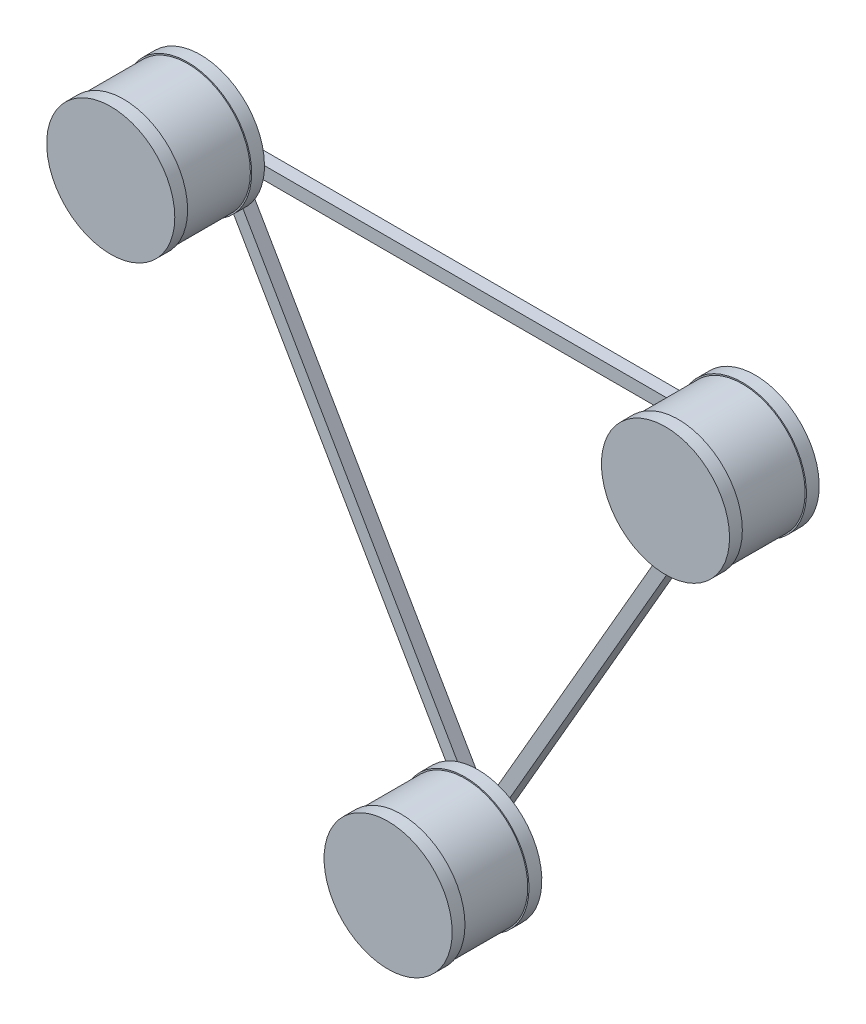
from build123d import *

# Parameters (mm, degrees)
BOSS_EXTRUDE1_DEPTH = 2.5
SKETCH2_R           = 25
BOSS_EXTRUDE2_DEPTH = 5
SKETCH3_R           = 5
BOSS_EXTRUDE3_DEPTH = 25
SKETCH4_R           = 25
BOSS_EXTRUDE4_DEPTH = 5
SKETCH5_R           = 24.5
SKETCH5_R_2         = 5.5
BOSS_EXTRUDE5_DEPTH = 25


with BuildPart() as part:
    # Sketch1 → Boss-Extrude1 (new, symmetric)
    with BuildSketch(Plane.XY):
        Polygon((0, -125), (-108.253175473, 62.5), (108.253175473, 62.5), align=None)
        Polygon((0, -115), (-99.592921435, 57.5), (99.592921435, 57.5), align=None, mode=Mode.SUBTRACT)
    extrude(amount=BOSS_EXTRUDE1_DEPTH, both=True)

    # Sketch2 → Boss-Extrude2 (add)
    with BuildSketch(Plane.XY.offset(2.5)):
        with Locations((-108.253175473, 62.5)):
            Circle(SKETCH2_R)
        with Locations(Location((108.253175473, 62.5, 0), (0, 0, 180))):
            Circle(SKETCH2_R)
        with Locations(Location((0, -125, 0), (0, 0, 120))):
            Circle(SKETCH2_R)
    extrude(amount=BOSS_EXTRUDE2_DEPTH)

    # Sketch3 → Boss-Extrude3 (add)
    with BuildSketch(Plane.XY.offset(7.5)):
        with Locations((-108.253175473, 62.5)):
            Circle(SKETCH3_R)
        with Locations(Location((108.253175473, 62.5, 0), (0, 0, 180))):
            Circle(SKETCH3_R)
        with Locations((0, -125)):
            Circle(SKETCH3_R)
    extrude(amount=BOSS_EXTRUDE3_DEPTH)

    # Sketch4 → Boss-Extrude4 (add)
    with BuildSketch(Plane.XY.offset(32.5)):
        with Locations(Location((0, -125, 0), (0, 0, 120))):
            Circle(SKETCH4_R)
        with Locations(Location((108.253175473, 62.5, 0), (0, 0, 180))):
            Circle(SKETCH4_R)
        with Locations((-108.253175473, 62.5)):
            Circle(SKETCH4_R)
    extrude(amount=BOSS_EXTRUDE4_DEPTH)

    # Sketch5 → Boss-Extrude5 (add)
    # profile 1 of 3: a face of its own
    with BuildSketch(Plane.XY.offset(7.5)):
        with Locations((-108.253175473, 62.5)):
            Circle(SKETCH5_R)
        with Locations((-108.253175473, 62.5)):
            Circle(SKETCH5_R_2, mode=Mode.SUBTRACT)
    # profile 2 of 3: a face of its own
    with BuildSketch(Plane.XY.offset(7.5)):
        with Locations(Location((108.253175473, 62.5, 0), (0, 0, 180))):
            Circle(SKETCH5_R)
        with Locations((108.253175473, 62.5)):
            Circle(SKETCH5_R_2, mode=Mode.SUBTRACT)
    # profile 3 of 3: a face of its own
    with BuildSketch(Plane.XY.offset(7.5)):
        with Locations((0, -125)):
            Circle(SKETCH5_R)
        with Locations((0, -125)):
            Circle(SKETCH5_R_2, mode=Mode.SUBTRACT)
    extrude(amount=BOSS_EXTRUDE5_DEPTH)


solid = part.part
